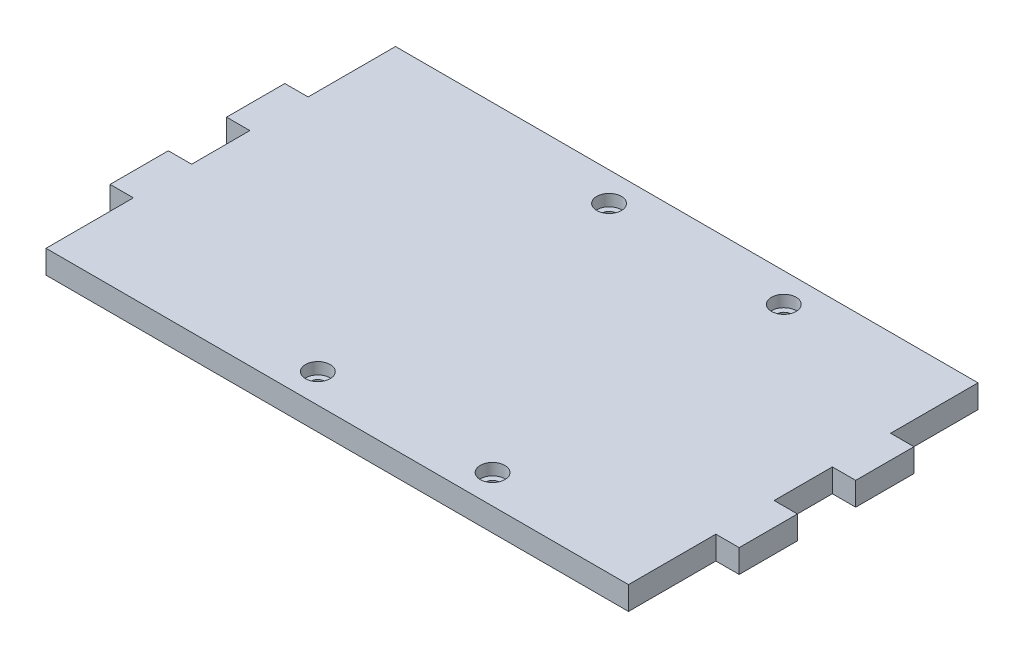
from build123d import *

# Parameters (mm, degrees)
BOSS_EXTRUDE1_DEPTH = 6
SKETCH2_R           = 1.75
CUT_EXTRUDE1_DEPTH  = 6
SKETCH3_R           = 3.175
CUT_EXTRUDE2_DEPTH  = 3


with BuildPart() as part:
    # Sketch1 → Boss-Extrude1 (new body)
    with BuildSketch(Plane(origin=(0, 0, 0), x_dir=(1, 0, 0), z_dir=(0, 1, 0))):
        Polygon((-75, -45), (75, -45), (75, -22.5), (81, -22.5), (81, -7.5), (75, -7.5), (75, 7.5), (81, 7.5), (81, 22.5), (75, 22.5), (75, 45), (-75, 45), (-75, 22.5), (-81, 22.5), (-81, 7.5), (-75, 7.5), (-75, -7.5), (-81, -7.5), (-81, -22.5), (-75, -22.5), align=None)
    extrude(amount=BOSS_EXTRUDE1_DEPTH)

    # Sketch2 → Cut-Extrude1 (cut)
    with BuildSketch(Plane(origin=(0, 6, 0), x_dir=(1, 0, 0), z_dir=(0, 1, 0))):
        with Locations(Location((32.5, 37.5, 0), (0, 0, 270))):
            Circle(SKETCH2_R)
        with Locations(Location((32.5, -37.5, 0), (0, 0, 270))):
            Circle(SKETCH2_R)
        with Locations(Location((-12.5, 37.5, 0), (0, 0, 270))):
            Circle(SKETCH2_R)
        with Locations(Location((-12.5, -37.5, 0), (0, 0, 270))):
            Circle(SKETCH2_R)
    extrude(amount=-CUT_EXTRUDE1_DEPTH, mode=Mode.SUBTRACT)

    # Sketch3 → Cut-Extrude2 (cut)
    with BuildSketch(Plane(origin=(0, 6, 0), x_dir=(1, 0, 0), z_dir=(0, 1, 0))):
        with Locations(Location((-12.5, 37.5, 0), (0, 0, 270))):
            Circle(SKETCH3_R)
        with Locations(Location((32.5, 37.5, 0), (0, 0, 270))):
            Circle(SKETCH3_R)
        with Locations(Location((32.5, -37.5, 0), (0, 0, 270))):
            Circle(SKETCH3_R)
        with Locations(Location((-12.5, -37.5, 0), (0, 0, 270))):
            Circle(SKETCH3_R)
    extrude(amount=-CUT_EXTRUDE2_DEPTH, mode=Mode.SUBTRACT)


solid = part.part
